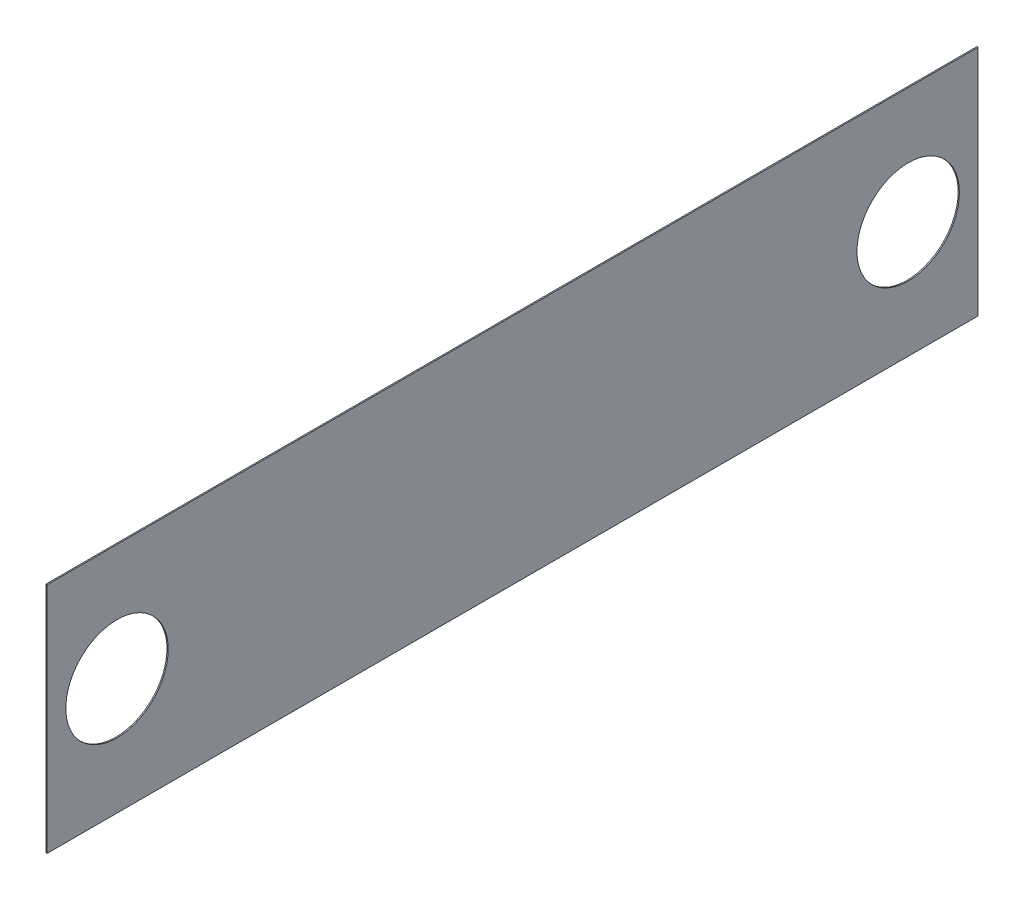
from build123d import *

# Parameters (mm, degrees)
SKETCH1_W             = 100
SKETCH1_H             = 25
BOSS_EXTRUDE1_DEPTH   = 0.127
M10_CLEARANCE_HOLE1_D = 11


with BuildPart() as part:
    # Sketch1 → Boss-Extrude1 (new body)
    with BuildSketch(Plane(origin=(0, 0, 0), x_dir=(0, 0, -1), z_dir=(1, 0, 0))):
        Rectangle(SKETCH1_W, SKETCH1_H)
    extrude(amount=BOSS_EXTRUDE1_DEPTH)

    # M10 Clearance Hole1 (through all)
    with Locations(Plane(origin=(0.127, 0, 0), x_dir=(0, 0, -1), z_dir=(1, 0, 0))):
        with Locations((-42.5, 0), (42.5, 0)):
            Hole(M10_CLEARANCE_HOLE1_D / 2)


solid = part.part
